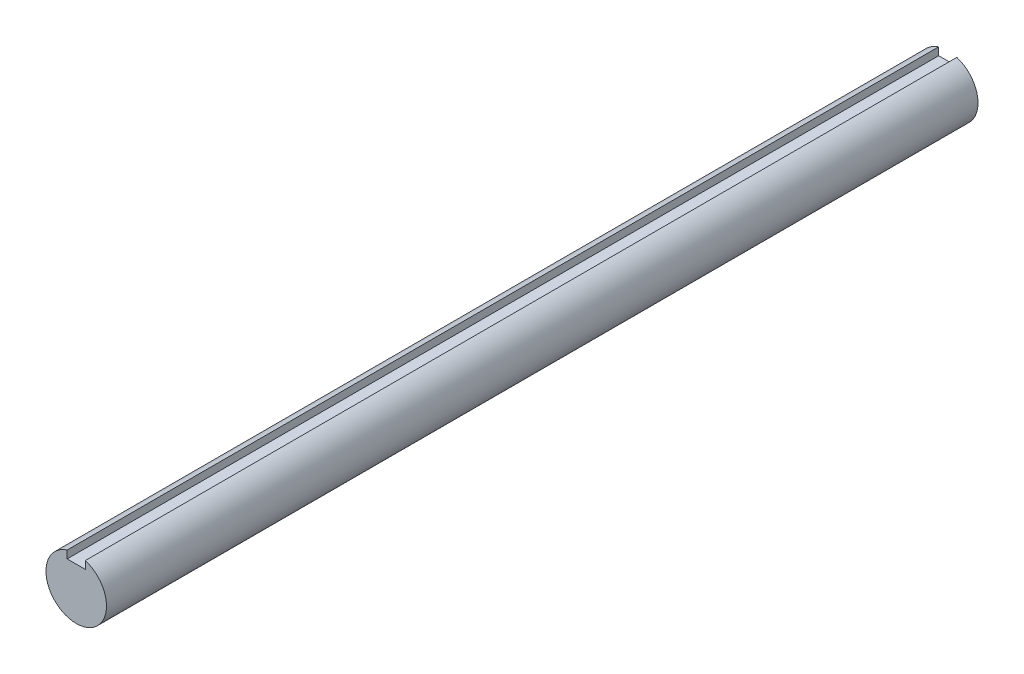
from build123d import *

# Parameters (mm, degrees)
BOSS_EXTRUDE1_DEPTH      = 57.15
BOSS_EXTRUDE1_DEPTH_BACK = 57.15


with BuildPart() as part:
    # Sketch3 → Boss-Extrude1 (new, two sides: drawn at the far end of the back side and taken through both)
    with BuildSketch(Plane.XY.offset(-BOSS_EXTRUDE1_DEPTH_BACK)):
        with BuildLine():
            Line((-1.1938, 2.77495), (-1.1938, 3.784946251))
            ThreePointArc((-1.1938, 3.784946251), (0, -3.96875), (1.1938, 3.784946251))
            Line((1.1938, 3.784946251), (1.1938, 2.77495))
            Line((1.1938, 2.77495), (-1.1938, 2.77495))
        make_face()
    extrude(amount=BOSS_EXTRUDE1_DEPTH + BOSS_EXTRUDE1_DEPTH_BACK)


solid = part.part
